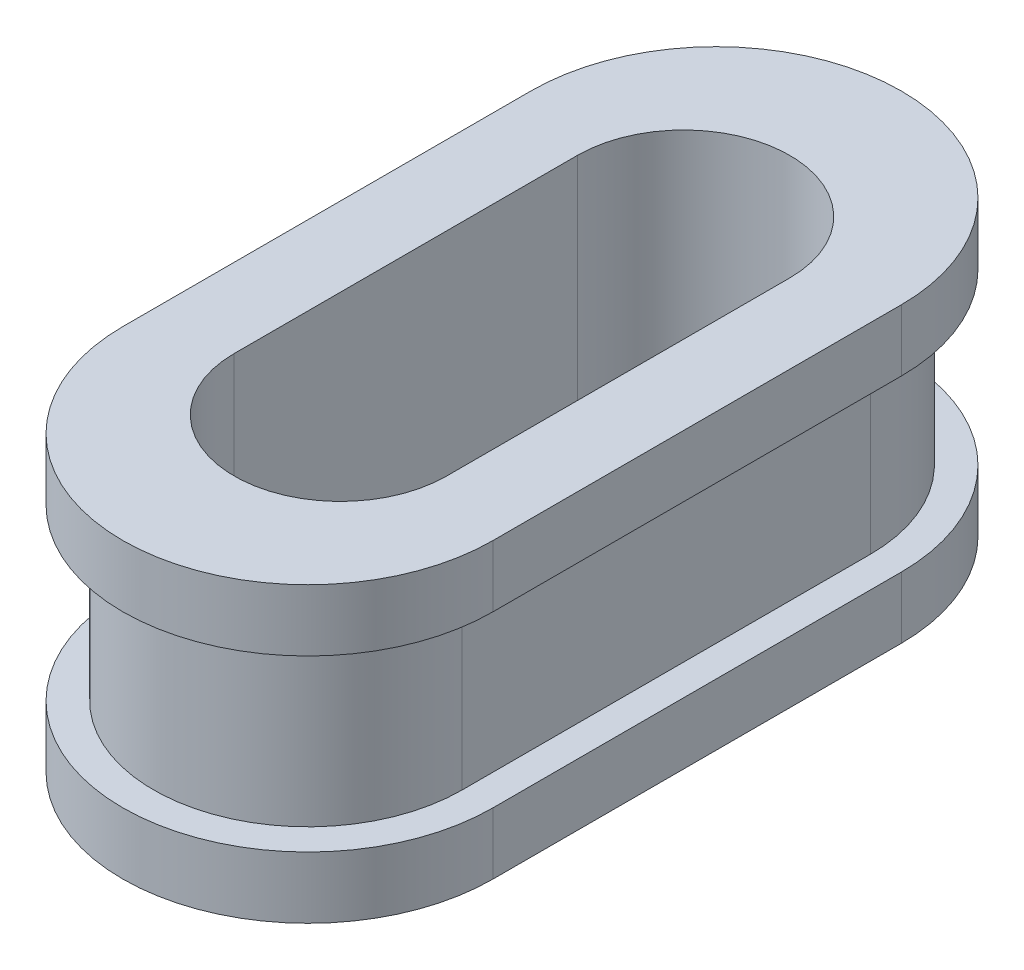
from build123d import *

# Parameters (mm, degrees)
BOSS_EXTRUDE1_DEPTH     = 10
BOSS_EXTRUDE2_DEPTH     = 27.5
BOSS_EXTRUDE3_DEPTH     = 10
CUT_EXTRUDE1_DEPTH      = 146.564029734
CUT_EXTRUDE1_DEPTH_BACK = 146.564029734


with BuildPart() as part:
    # Sketch1 → Boss-Extrude1 (new body)
    with BuildSketch(Plane(origin=(0, 0, 0), x_dir=(1, 0, 0), z_dir=(0, 1, 0))):
        with BuildLine():
            Line((-30, 104.285653561), (-30, 38.155653561))
            ThreePointArc((-30, 38.155653561), (0, 8.155653561), (30, 38.155653561))
            Line((30, 38.155653561), (30, 104.285653561))
            ThreePointArc((30, 104.285653561), (0, 134.285653561), (-30, 104.285653561))
        make_face()
    extrude(amount=BOSS_EXTRUDE1_DEPTH)

    # Sketch2 → Boss-Extrude2 (add)
    with BuildSketch(Plane(origin=(0, 10, 0), x_dir=(1, 0, 0), z_dir=(0, 1, 0))):
        with BuildLine():
            Line((-25, 104.285653561), (-25, 38.155653561))
            ThreePointArc((-25, 38.155653561), (0, 13.155653561), (25, 38.155653561))
            Line((25, 38.155653561), (25, 104.285653561))
            ThreePointArc((25, 104.285653561), (0, 129.285653561), (-25, 104.285653561))
        make_face()
    extrude(amount=BOSS_EXTRUDE2_DEPTH)

    # Sketch3 → Boss-Extrude3 (add)
    with BuildSketch(Plane(origin=(0, 37.5, 0), x_dir=(1, 0, 0), z_dir=(0, 1, 0))):
        with BuildLine():
            Line((-30, 104.285653561), (-30, 38.155653561))
            ThreePointArc((-30, 38.155653561), (0, 8.155653561), (30, 38.155653561))
            Line((30, 38.155653561), (30, 104.285653561))
            ThreePointArc((30, 104.285653561), (0, 134.285653561), (-30, 104.285653561))
        make_face()
    extrude(amount=BOSS_EXTRUDE3_DEPTH)

    # Sketch4 → Cut-Extrude1 (cut, two sides: drawn at the far end of the back side and taken through both)
    with BuildSketch(Plane(origin=(0, 47.5, 0), x_dir=(1, 0, 0), z_dir=(0, 1, 0)).offset(-CUT_EXTRUDE1_DEPTH_BACK)):
        with BuildLine():
            Line((-17.2, 99.020653561), (-17.2, 43.420653561))
            ThreePointArc((-17.2, 43.420653561), (0, 26.220653561), (17.2, 43.420653561))
            Line((17.2, 43.420653561), (17.2, 99.020653561))
            ThreePointArc((17.2, 99.020653561), (0, 116.220653561), (-17.2, 99.020653561))
        make_face()
    extrude(amount=CUT_EXTRUDE1_DEPTH + CUT_EXTRUDE1_DEPTH_BACK, mode=Mode.SUBTRACT)


solid = part.part
